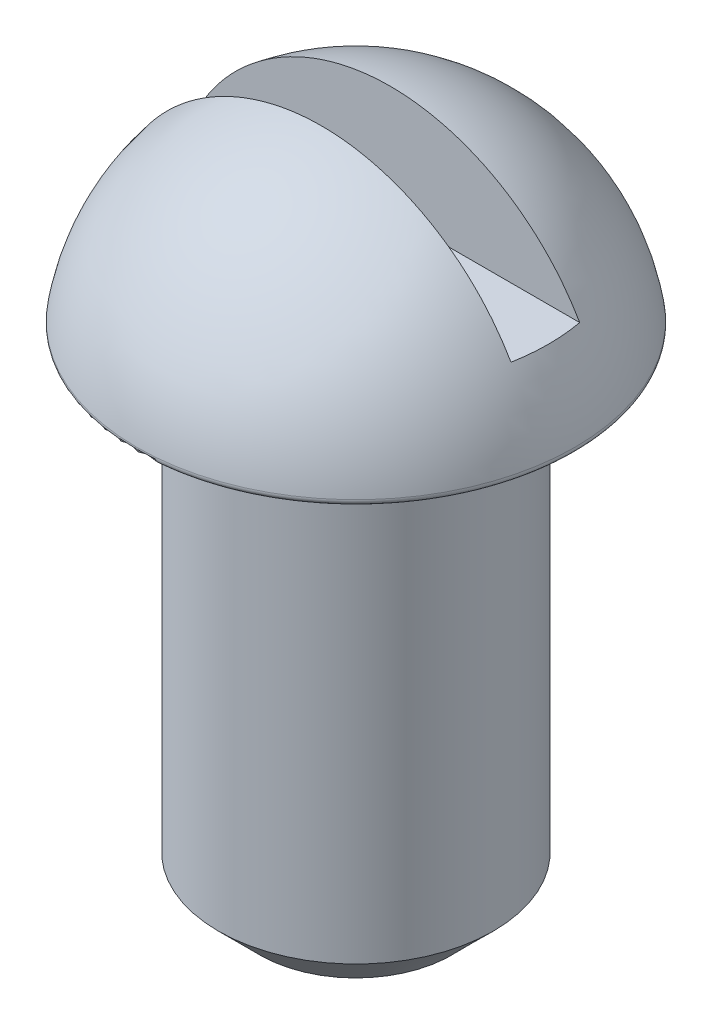
from build123d import *

# Parameters (mm, degrees)
SKETCH_13_W         = 16
SKETCH_13_H         = 2.5
CUT_EXTRUDE_9_DEPTH = 4
FILLET_1_R          = 0.2
CHAMFER_1_SIZE      = 1.5


with BuildPart() as part:
    # Эскиз1 → Повернуть1 (revolve)
    with BuildSketch(Plane.XY):
        with BuildLine():
            Line((5, 87.24931314), (8, 87.24931314))
            ThreePointArc((8, 87.24931314), (5.792315708, 91.874939001), (1.25, 94.24931314))
            Line((1.25, 94.24931314), (0, 94.24931314))
            Line((0, 94.24931314), (0, 69.24931314))
            Line((0, 69.24931314), (5, 69.24931314))
            Line((5, 69.24931314), (5, 87.24931314))
        make_face()
    revolve(axis=Axis((0, 125.763182898, 0), (0, -1, 0)))

    # Эскиз13 → Вырез-Вытянуть9 (cut)
    with BuildSketch(Plane(origin=(0, 94.24931314, 0), x_dir=(-1, 0, 0), z_dir=(0, 1, 0))):
        Rectangle(SKETCH_13_W, SKETCH_13_H)
    extrude(amount=-CUT_EXTRUDE_9_DEPTH, mode=Mode.SUBTRACT)

    # Скругление1
    fillet_1_edges = [part.edges().sort_by_distance(p)[0] for p in [
        (-8, 87.24931314, 0),
    ]]
    fillet(fillet_1_edges, radius=FILLET_1_R)

    # Фаска1
    chamfer_1_edges = [part.edges().sort_by_distance(p)[0] for p in [
        (-5, 69.24931314, 0),
    ]]
    chamfer(chamfer_1_edges, length=CHAMFER_1_SIZE)


solid = part.part
